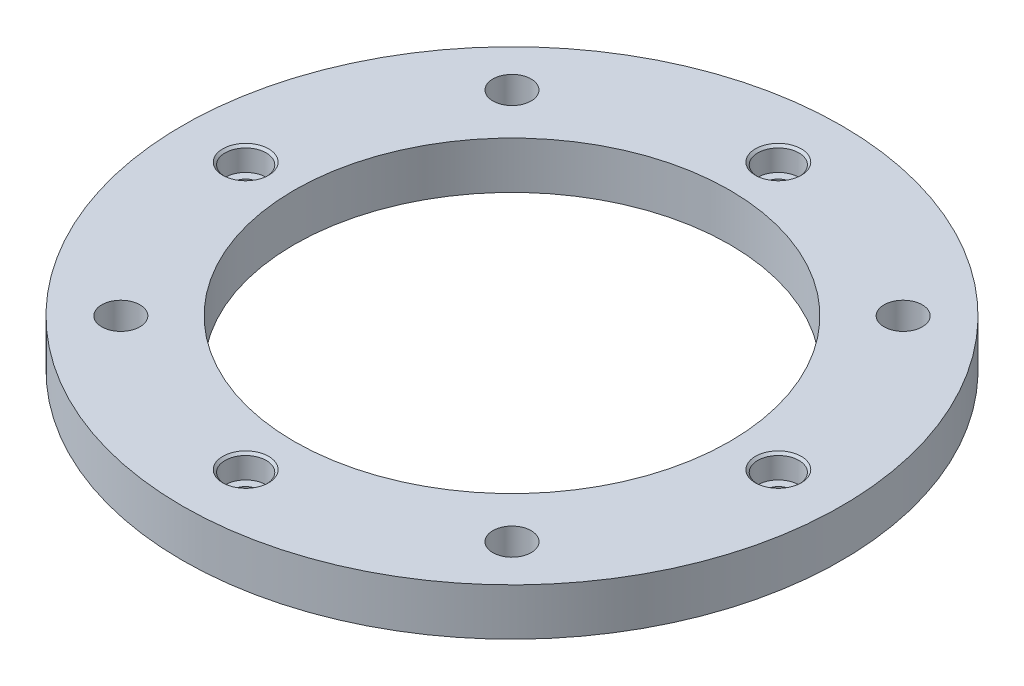
from build123d import *

# Parameters (mm, degrees)
SKETCH1_W                                     = 177.8
SKETCH1_H                                     = 177.8
BOSS_EXTRUDE1_DEPTH                           = 12.7
F_13_32_0_40625_DIAMETER_HOLE1_D              = 10.31875
F_13_32_0_40625_DIAMETER_HOLE1_DEPTH          = 25.4
F_13_32_0_40625_DIAMETER_HOLE1_TIP            = 3.100065256
SKETCH4_R                                     = 58.7375
CUT_EXTRUDE1_DEPTH                            = 127.363404513
SKETCH5_OUTSIDE_W                             = 230.154
SKETCH5_OUTSIDE_H                             = 230.154
SKETCH5_OUTSIDE_R                             = 88.9
CUT_EXTRUDE2_DEPTH                            = 12.7
CBORE_FOR_1_4_SOCKET_HEAD_CAP_SCREW1_AT_COUNT = 2
CBORE_FOR_1_4_SOCKET_HEAD_CAP_SCREW1_AT_PITCH = 101.6
CBORE_FOR_1_4_SOCKET_HEAD_CAP_SCREW1_2_COUNT  = 2
CBORE_FOR_1_4_SOCKET_HEAD_CAP_SCREW1_2_PITCH  = 101.6
CBORE_FOR_1_4_SOCKET_HEAD_CAP_SCREW1_3_COUNT  = 2
CBORE_FOR_1_4_SOCKET_HEAD_CAP_SCREW1_3_PITCH  = 143.684097937


with BuildPart() as part:
    # Sketch1 → Boss-Extrude1 (new body)
    with BuildSketch(Plane(origin=(0, 0, 0), x_dir=(1, 0, 0), z_dir=(0, 1, 0))):
        Rectangle(SKETCH1_W, SKETCH1_H)
    extrude(amount=BOSS_EXTRUDE1_DEPTH)

    # 13/32 (0.40625) Diameter Hole1
    with Locations(Plane(origin=(-52.759004711, 12.7, -52.759004711), x_dir=(0, 0, 1), z_dir=(0, 1, 0))):
        with Locations((0, 0), (0, 105.518009422), (105.518009422, 105.518009422), (105.518009422, 0)):
            Hole(F_13_32_0_40625_DIAMETER_HOLE1_D / 2, depth=F_13_32_0_40625_DIAMETER_HOLE1_DEPTH)
            with Locations((0, 0, -(F_13_32_0_40625_DIAMETER_HOLE1_DEPTH + F_13_32_0_40625_DIAMETER_HOLE1_TIP / 2))):  # 118° drill point
                Cone(0, F_13_32_0_40625_DIAMETER_HOLE1_D / 2, F_13_32_0_40625_DIAMETER_HOLE1_TIP, mode=Mode.SUBTRACT)

    # Sketch4 → Cut-Extrude1 (cut, through all)
    with BuildSketch(Plane(origin=(0, 12.7, 0), x_dir=(1, 0, 0), z_dir=(0, 1, 0))):
        with Locations(Location((0, 0, 0), (0, 0, 270))):
            Circle(SKETCH4_R)
    extrude(amount=-CUT_EXTRUDE1_DEPTH, mode=Mode.SUBTRACT)

    # Sketch5 outside → Cut-Extrude2 (cut)
    with BuildSketch(Plane(origin=(0, 12.7, 0), x_dir=(1, 0, 0), z_dir=(0, 1, 0))):
        Rectangle(SKETCH5_OUTSIDE_W, SKETCH5_OUTSIDE_H)
        with Locations(Location((0, 0, 0), (0, 0, 270))):
            Circle(SKETCH5_OUTSIDE_R, mode=Mode.SUBTRACT)
    extrude(amount=-CUT_EXTRUDE2_DEPTH, mode=Mode.SUBTRACT)

    # Sketch9 → CBORE for 1/4 Socket Head Cap Screw1 (revolve, cut)
    with BuildSketch(Plane(origin=(0, 12.7, -71.842048969), x_dir=(0, 0, 1), z_dir=(1, 0, 0))):
        Polygon((0, 0), (0, 12.7), (3.3782, 12.7), (3.3782, 6.35), (5.55625, 6.35), (5.55625, 0.635), (6.19125, 0), align=None)
    cbore_for_1_4_socket_head_cap_screw1 = revolve(axis=Axis((0, 19.05, -71.842048969), (0, -1, 0)), mode=Mode.SUBTRACT)

    # CBORE for 1/4 Socket Head Cap Screw1 at: CBORE for 1/4 Socket Head Cap Screw1 ×2
    with Locations(*[Vector(0.7071067811865476, 0, 0.7071067811865476) * (i * CBORE_FOR_1_4_SOCKET_HEAD_CAP_SCREW1_AT_PITCH) for i in range(1, CBORE_FOR_1_4_SOCKET_HEAD_CAP_SCREW1_AT_COUNT)]):
        add(cbore_for_1_4_socket_head_cap_screw1, mode=Mode.SUBTRACT)

    # CBORE for 1_4 Socket Head Cap Screw1 2: CBORE for 1/4 Socket Head Cap Screw1 ×2
    with Locations(*[Vector(-0.7071067811865475, 0, 0.7071067811865476) * (i * CBORE_FOR_1_4_SOCKET_HEAD_CAP_SCREW1_2_PITCH) for i in range(1, CBORE_FOR_1_4_SOCKET_HEAD_CAP_SCREW1_2_COUNT)]):
        add(cbore_for_1_4_socket_head_cap_screw1, mode=Mode.SUBTRACT)

    # CBORE for 1_4 Socket Head Cap Screw1 3: CBORE for 1/4 Socket Head Cap Screw1 ×2
    with Locations(*[(0, 0, i * CBORE_FOR_1_4_SOCKET_HEAD_CAP_SCREW1_3_PITCH) for i in range(1, CBORE_FOR_1_4_SOCKET_HEAD_CAP_SCREW1_3_COUNT)]):
        add(cbore_for_1_4_socket_head_cap_screw1, mode=Mode.SUBTRACT)


solid = part.part
